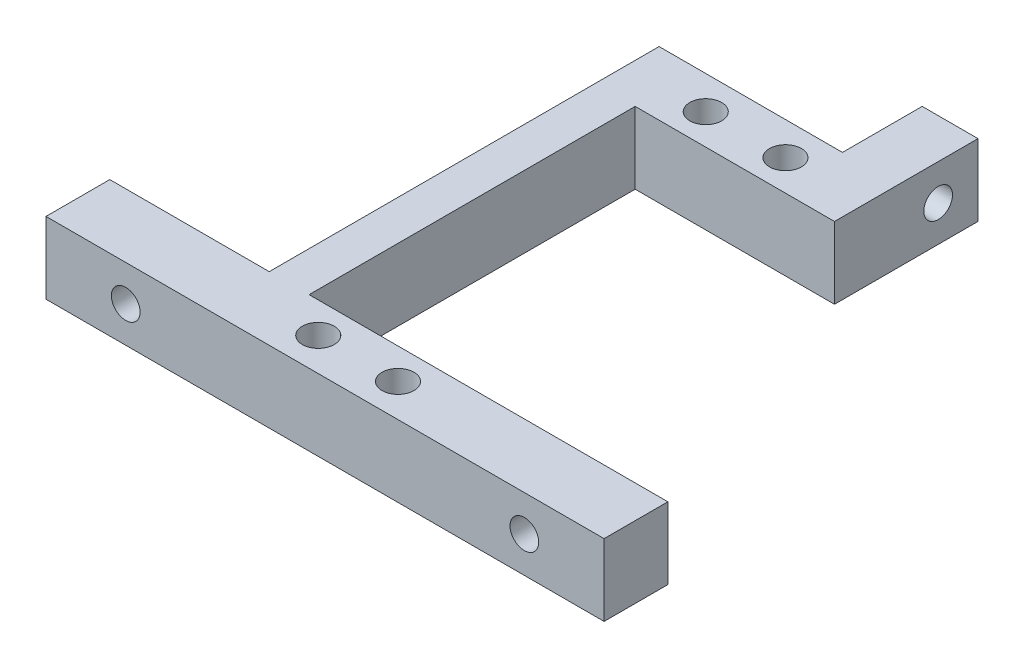
from build123d import *

# Parameters (mm, degrees)
ESQUISSE1_W             = 70
ESQUISSE1_H             = 9
ESQUISSE1_R             = 1.8
BOSS_EXTRU_1_DEPTH      = 8
ESQUISSE2_R             = 2
ENL_V_MAT_EXTRU_1_DEPTH = 10
ESQUISSE3_R             = 2
BOSS_EXTRU_2_DEPTH      = 9
ESQUISSE4_W             = 5
ESQUISSE4_H             = 48.9
ENL_V_MAT_EXTRU_2_DEPTH = 10
ESQUISSE5_W             = 10
ESQUISSE5_H             = 9
ESQUISSE5_R             = 1.8
BOSS_EXTRU_3_DEPTH      = 7


with BuildPart() as part:
    # Esquisse1 → Boss.-Extru.1 (new body)
    with BuildSketch(Plane.XY):
        with Locations((35, 4.5)):
            Rectangle(ESQUISSE1_W, ESQUISSE1_H)
        with Locations((10, 4.5)):
            Circle(ESQUISSE1_R, mode=Mode.SUBTRACT)
        with Locations((60, 4.5)):
            Circle(ESQUISSE1_R, mode=Mode.SUBTRACT)
    extrude(amount=BOSS_EXTRU_1_DEPTH)

    # Esquisse2 → Enlèv. mat.-Extru.1 (cut)
    with BuildSketch(Plane.XZ):
        with Locations((30, 3.85)):
            Circle(ESQUISSE2_R)
        with Locations((40, 3.85)):
            Circle(ESQUISSE2_R)
    extrude(amount=-ENL_V_MAT_EXTRU_1_DEPTH, mode=Mode.SUBTRACT)

    # Esquisse3 → Boss.-Extru.2 (add)
    with BuildSketch(Plane(origin=(0, 9, 0), x_dir=(1, 0, 0), z_dir=(0, 1, 0))):
        Polygon((50, 0), (55, 0), (55, 48.9), (20, 48.9), (20, 0), (25, 0), (25, 40.9), (50, 40.9), align=None)
        with Locations(Location((30, 44.75, 0), (0, 0, 180))):
            Circle(ESQUISSE3_R, mode=Mode.SUBTRACT)
        with Locations(Location((40, 44.75, 0), (0, 0, 180))):
            Circle(ESQUISSE3_R, mode=Mode.SUBTRACT)
    extrude(amount=-BOSS_EXTRU_2_DEPTH)

    # Esquisse4 → Enlèv. mat.-Extru.2 (cut)
    with BuildSketch(Plane(origin=(0, 9, 0), x_dir=(1, 0, 0), z_dir=(0, 1, 0))):
        with Locations((52.5, 24.45)):
            Rectangle(ESQUISSE4_W, ESQUISSE4_H)
    extrude(amount=-ENL_V_MAT_EXTRU_2_DEPTH, mode=Mode.SUBTRACT)

    # Esquisse5 → Boss.-Extru.3 (add)
    with BuildSketch(Plane(origin=(50, 0, 0), x_dir=(0, 0, -1), z_dir=(1, 0, 0))):
        with Locations((53.9, 4.5)):
            Rectangle(ESQUISSE5_W, ESQUISSE5_H)
        with Locations(Location((53.9, 4.5, 0), (0, 0, 90))):
            Circle(ESQUISSE5_R, mode=Mode.SUBTRACT)
    extrude(amount=-BOSS_EXTRU_3_DEPTH)


solid = part.part
